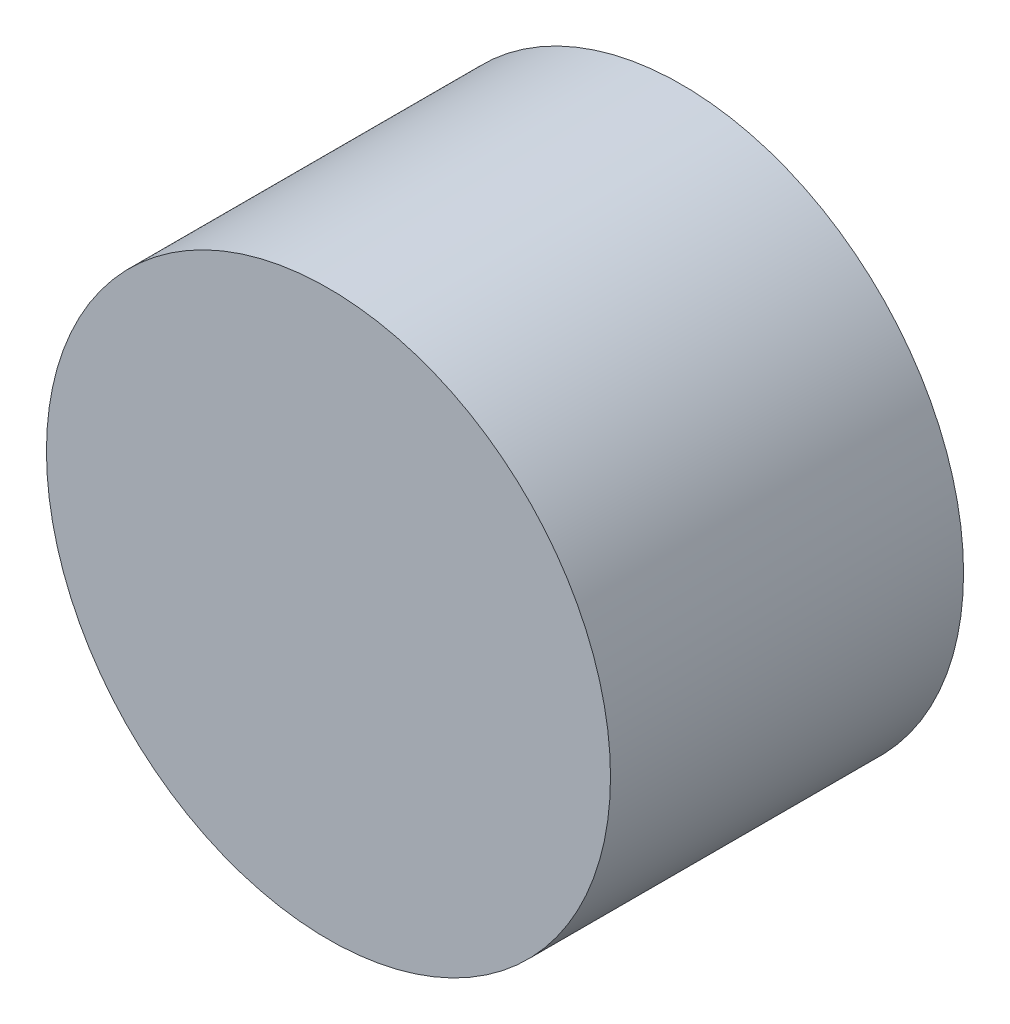
from build123d import *

# Parameters (mm, degrees)
IZIM1_R                     = 20.77018178
Y_KSEKLIK_EKSTR_ZYON1_DEPTH = 26


with BuildPart() as part:
    # Çizim1 → Yükseklik-Ekstrüzyon1 (new body)
    with BuildSketch(Plane.XY):
        with Locations(Location((-19.588060546, 18.147573657, 0), (0, 0, 180))):
            Circle(IZIM1_R)
    extrude(amount=Y_KSEKLIK_EKSTR_ZYON1_DEPTH)


solid = part.part
